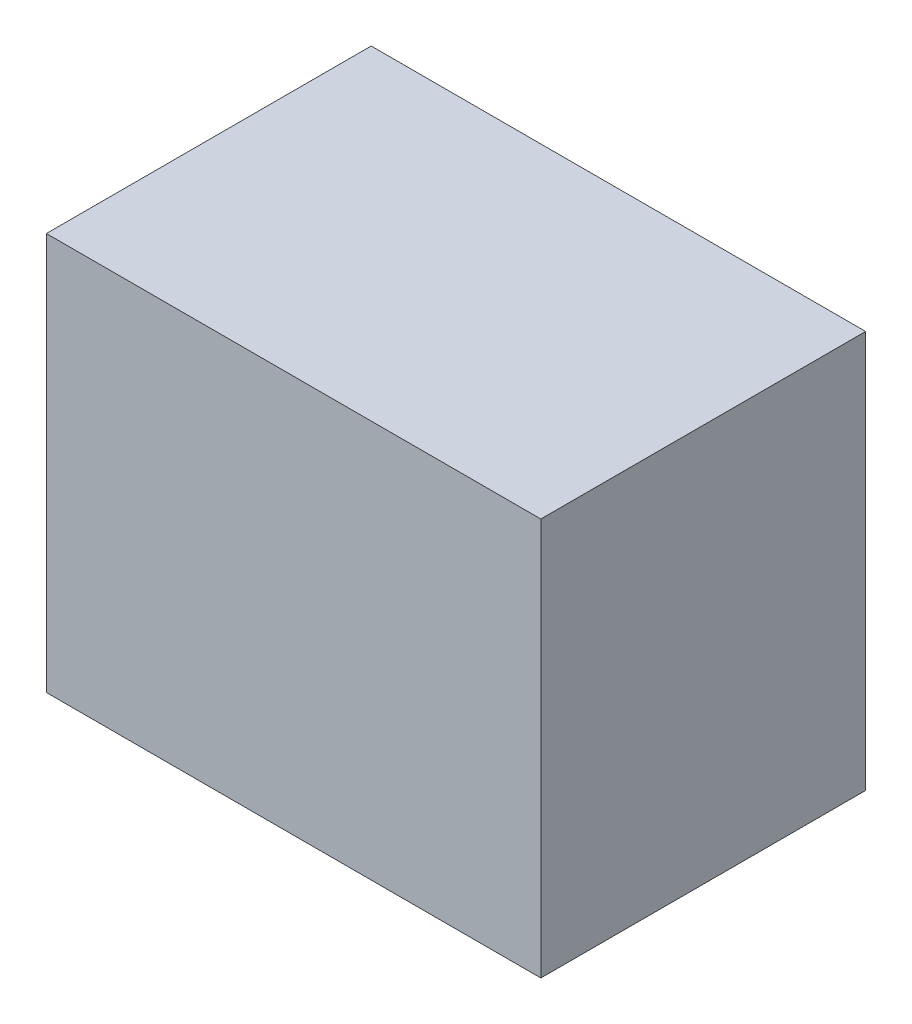
from build123d import *

# Parameters (mm, degrees)
SKETCH1_W           = 259.08
SKETCH1_H           = 170.18
BOSS_EXTRUDE1_DEPTH = 208.28


with BuildPart() as part:
    # Sketch1 → Boss-Extrude1 (new body)
    with BuildSketch(Plane(origin=(0, 0, 0), x_dir=(1, 0, 0), z_dir=(0, 1, 0))):
        with Locations((129.54, 85.09)):
            Rectangle(SKETCH1_W, SKETCH1_H)
    extrude(amount=BOSS_EXTRUDE1_DEPTH)


solid = part.part
